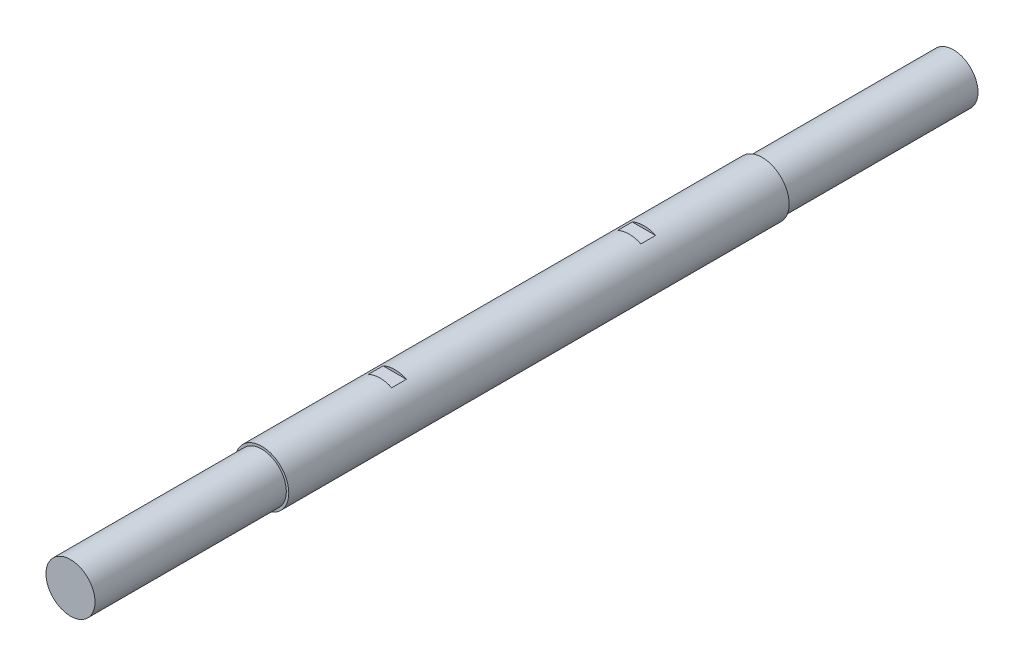
from build123d import *

# Parameters (mm, degrees)
SKETCH1_W          = 360
SKETCH1_H          = 11
SKETCH4_W          = 6
SKETCH4_H          = 10
CUT_EXTRUDE1_DEPTH = 181.670971658
SKETCH6_W          = 78
SKETCH6_H          = 1


with BuildPart() as part:
    # Sketch1 → Revolve1 (revolve)
    with BuildSketch(Plane(origin=(0, 0, 0), x_dir=(0, 0, -1), z_dir=(1, 0, 0)), mode=Mode.PRIVATE) as revolve1_sk:
        with Locations((0, 5.5)):
            Rectangle(SKETCH1_W, SKETCH1_H)
    revolve(revolve1_sk.sketch.rotate(Axis((0, 0, -180), (0, 0, 1)), 90), axis=Axis((0, 0, -180), (0, 0, 1)))

    # Sketch4 → Cut-Extrude1 (cut, symmetric)
    with BuildSketch(Plane(origin=(0, 0, 0), x_dir=(0, 0, -1), z_dir=(1, 0, 0))):
        with Locations((-50.8, 14.92)):
            Rectangle(SKETCH4_W, SKETCH4_H)
    cut_extrude1 = extrude(amount=CUT_EXTRUDE1_DEPTH, both=True, mode=Mode.SUBTRACT)

    # Sketch6 → Cut-Revolve1 (revolve, cut)
    with BuildSketch(Plane(origin=(0, 0, 0), x_dir=(0, 0, -1), z_dir=(1, 0, 0)), mode=Mode.PRIVATE) as cut_revolve1_sk:
        with Locations((-141, 10.5)):
            Rectangle(SKETCH6_W, SKETCH6_H)
    cut_revolve1 = revolve(cut_revolve1_sk.sketch.rotate(Axis((0, 0, -180), (0, 0, -1)), 270), axis=Axis((0, 0, -180), (0, 0, -1)), mode=Mode.SUBTRACT)

    # Mirror2: Cut-Extrude1, Cut-Revolve1 across plane
    add(cut_extrude1.mirror(Plane.XY), mode=Mode.SUBTRACT)
    add(cut_revolve1.mirror(Plane.XY), mode=Mode.SUBTRACT)


solid = part.part
